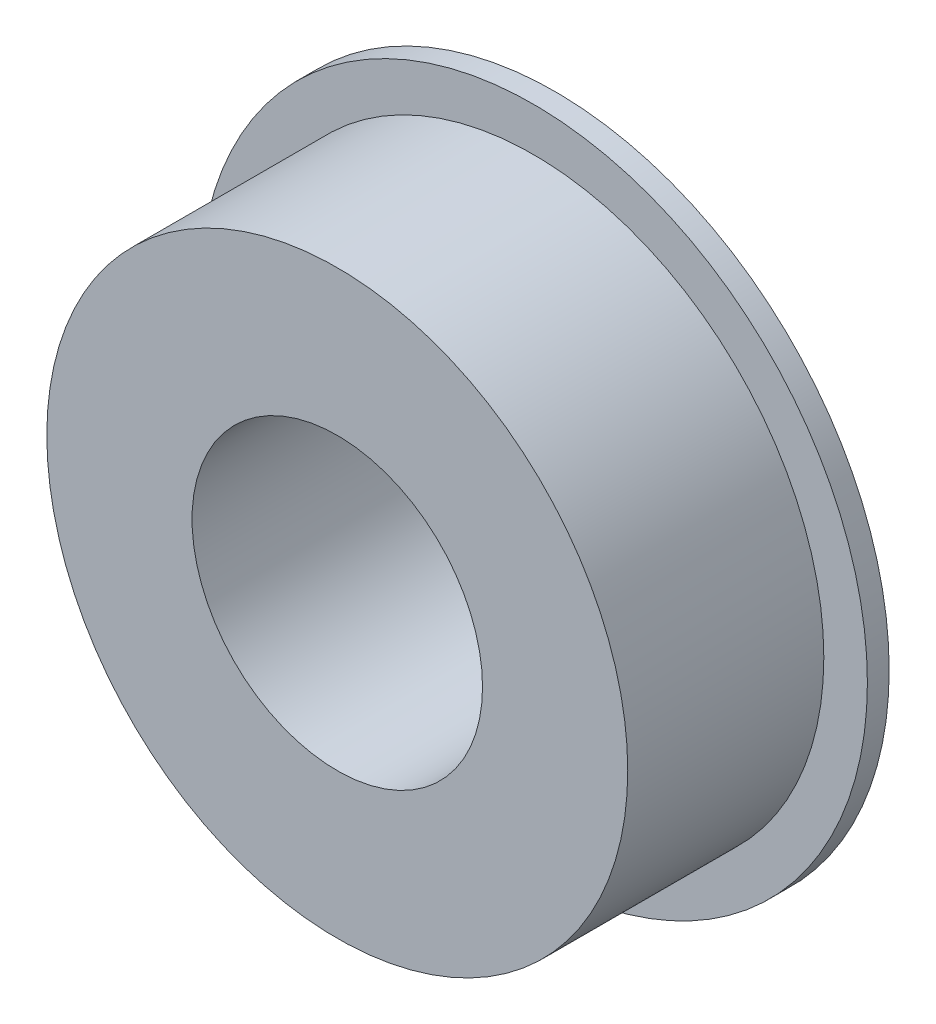
from build123d import *

# Parameters (mm, degrees)
F_4_0_4_DIAMETER_HOLE1_D     = 4
F_4_0_4_DIAMETER_HOLE1_DEPTH = 56.2
F_4_0_4_DIAMETER_HOLE1_TIP   = 1.201721238


with BuildPart() as part:
    # Sketch1 → Revolve1 (revolve)
    with BuildSketch(Plane(origin=(0, 0, 0), x_dir=(0, 0, -1), z_dir=(1, 0, 0)), mode=Mode.PRIVATE) as revolve1_sk:
        Polygon((0, 0), (0, 4.6), (-0.3, 4.6), (-0.3, 4), (-3, 4), (-3, 0), align=None)
    revolve(revolve1_sk.sketch.rotate(Axis((0, 0, 55), (0, 0, -1)), 90), axis=Axis((0, 0, 55), (0, 0, -1)))

    # Ø4.0 (4) Diameter Hole1
    with Locations(Plane.XY.offset(3)):
        with Locations((0, 0)):
            Hole(F_4_0_4_DIAMETER_HOLE1_D / 2, depth=F_4_0_4_DIAMETER_HOLE1_DEPTH)
            with Locations((0, 0, -(F_4_0_4_DIAMETER_HOLE1_DEPTH + F_4_0_4_DIAMETER_HOLE1_TIP / 2))):  # 118° drill point
                Cone(0, F_4_0_4_DIAMETER_HOLE1_D / 2, F_4_0_4_DIAMETER_HOLE1_TIP, mode=Mode.SUBTRACT)


solid = part.part
